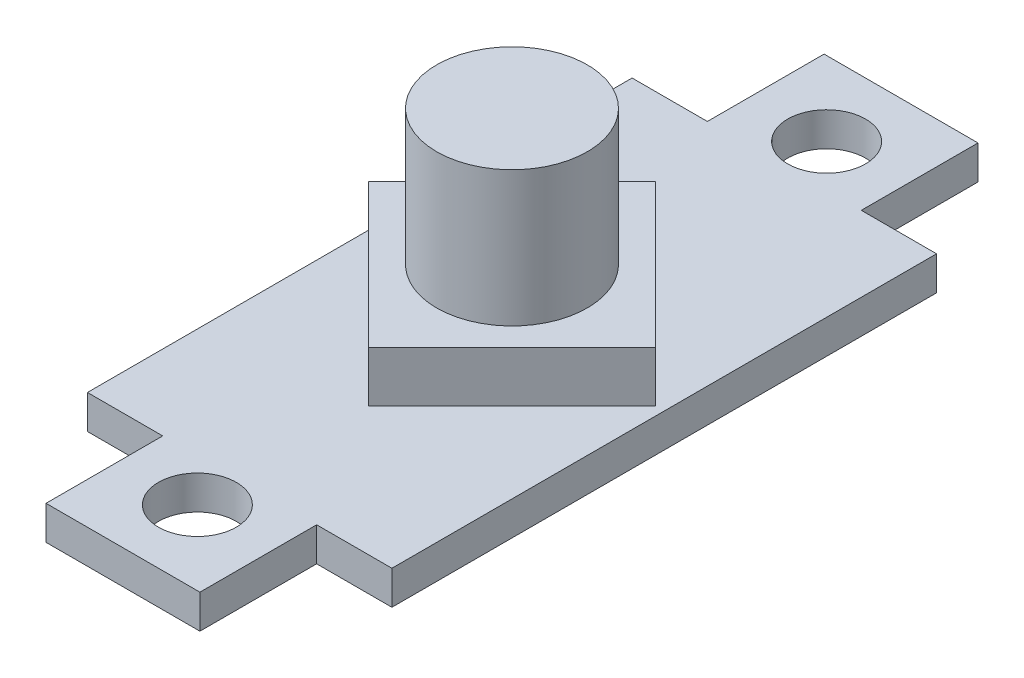
from build123d import *

# Parameters (mm, degrees)
SKETCH1_W           = 2.225
SKETCH1_H           = 16.1
SKETCH1_W_2         = 4.55
SKETCH1_H_2         = 3.45
SKETCH1_R           = 1.15
BOSS_EXTRUDE1_DEPTH = 1
BOSS_EXTRUDE2_DEPTH = 1.5
SKETCH3_R           = 2.226640197
BOSS_EXTRUDE3_DEPTH = 4


with BuildPart() as part:
    # Sketch1 → Boss-Extrude1 (new body)
    # profile 1 of 5: a face of its own
    with BuildSketch(Plane(origin=(0, 0, 0), x_dir=(1, 0, 0), z_dir=(0, 1, 0))):
        with Locations((-3.3875, 0)):
            Rectangle(SKETCH1_W, SKETCH1_H)
    # profile 2 of 5: a face of its own
    with BuildSketch(Plane(origin=(0, 0, 0), x_dir=(1, 0, 0), z_dir=(0, 1, 0))):
        with Locations((0, 9.775)):
            Rectangle(SKETCH1_W_2, SKETCH1_H_2)
        with Locations(Location((0, 9.3, 0), (0, 0, 270))):
            Circle(SKETCH1_R, mode=Mode.SUBTRACT)
    # profile 3 of 5: a face of its own
    with BuildSketch(Plane(origin=(0, 0, 0), x_dir=(1, 0, 0), z_dir=(0, 1, 0))):
        Rectangle(SKETCH1_W_2, SKETCH1_H)
    # profile 4 of 5: a face of its own
    with BuildSketch(Plane(origin=(0, 0, 0), x_dir=(1, 0, 0), z_dir=(0, 1, 0))):
        with Locations((3.3875, 0)):
            Rectangle(SKETCH1_W, SKETCH1_H)
    # profile 5 of 5: a face of its own
    with BuildSketch(Plane(origin=(0, 0, 0), x_dir=(1, 0, 0), z_dir=(0, 1, 0))):
        with Locations((0, -9.775)):
            Rectangle(SKETCH1_W_2, SKETCH1_H_2)
        with Locations(Location((0, -9.3, 0), (0, 0, 270))):
            Circle(SKETCH1_R, mode=Mode.SUBTRACT)
    extrude(amount=BOSS_EXTRUDE1_DEPTH)

    # Sketch2 → Boss-Extrude2 (add)
    with BuildSketch(Plane(origin=(0, 1, 0), x_dir=(1, 0, 0), z_dir=(0, 1, 0))):
        Polygon((0, -4.242640687), (4.242640687, 0), (0, 4.242640687), (-4.242640687, 0), align=None)
    extrude(amount=BOSS_EXTRUDE2_DEPTH)

    # Sketch3 → Boss-Extrude3 (add)
    with BuildSketch(Plane(origin=(0, 2.5, 0), x_dir=(1, 0, 0), z_dir=(0, 1, 0))):
        with Locations(Location((0, 0, 0), (0, 0, 270))):
            Circle(SKETCH3_R)
    extrude(amount=BOSS_EXTRUDE3_DEPTH)


solid = part.part
